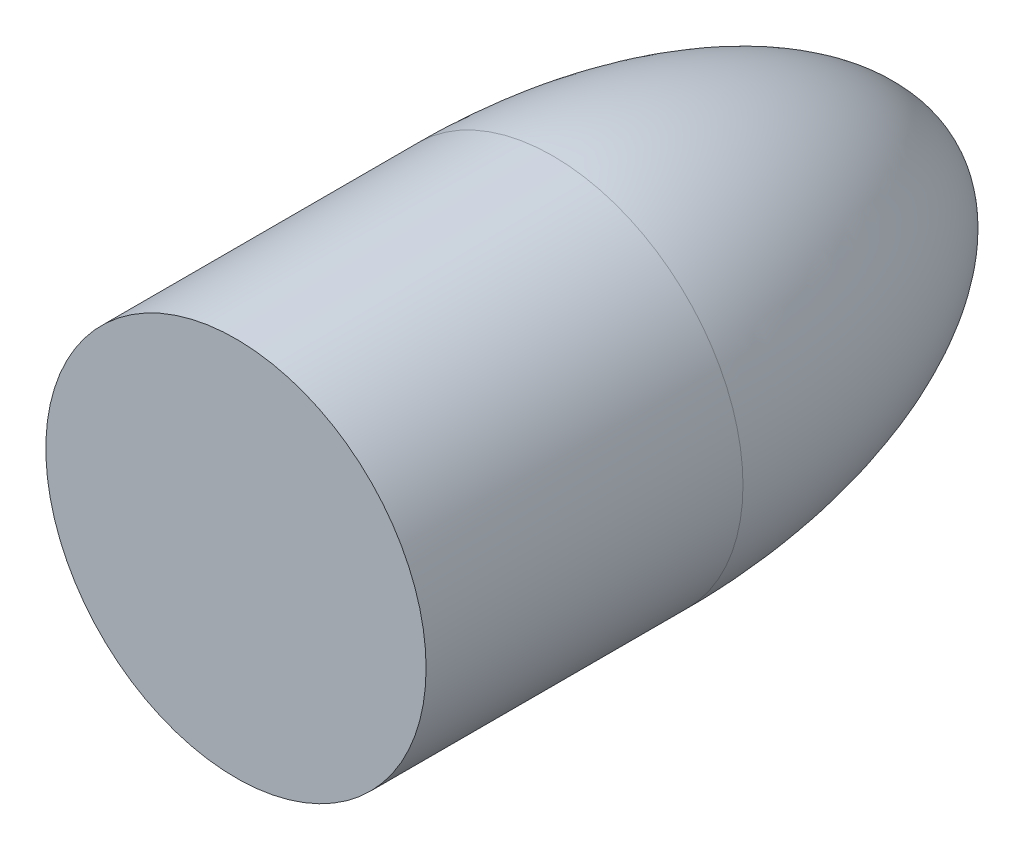
from build123d import *

# Parameters (mm, degrees)
SKETCH2_R           = 76.2
BOSS_EXTRUDE1_DEPTH = 127


with BuildPart() as part:
    # Sketch1 → Revolve1 (revolve)
    with BuildSketch(Plane(origin=(0, 0, 0), x_dir=(0, 0, -1), z_dir=(1, 0, 0))):
        with BuildLine():
            Line((0, 76.2), (0, 0))
            Line((0, 0), (152.4, 0))
            add(Edge.make_bspline(
                [(0, 76.2), (0.668289372, 76.2), (1.658377172, 76.196565322), (3.3475509, 76.185116398), (5.389853733, 76.15419687), (7.614877607, 76.109523753), (10.11699106, 76.037326106), (13.024492925, 75.927217822), (15.907103003, 75.789433001), (18.800559435, 75.623871169), (22.407781556, 75.382046396), (26.736601143, 75.035775637), (31.056706665, 74.618789713), (35.370872642, 74.130044616), (38.959265844, 73.674277381), (41.826515288, 73.280292829), (45.404997538, 72.750716915), (49.690121518, 72.055197513), (56.098298794, 70.897335382), (63.17836502, 69.40144931), (70.208811144, 67.686418914), (78.57143632, 65.349923384), (86.848909349, 62.723053301), (96.353872922, 59.205377282), (106.424617467, 54.721838361), (114.878251498, 50.221725855), (121.774263974, 45.922163688), (127.212316476, 42.047451876), (131.728642674, 38.421956079), (136.00130823, 34.510730011), (139.702159514, 30.582581399), (142.786533548, 26.756971466), (145.295615962, 23.10575563), (147.289840932, 19.698731723), (148.978819683, 16.224644789), (150.335170018, 12.715052828), (151.350644993, 9.207585726), (152.061016263, 5.5827392), (152.334424833, 2.8676648), (152.399993954, 1.007275164), (152.4, 0)],
                knots=[0.076303916, 0.076303916, 0.076303916, 0.076303916, 0.076303916, 0.090787477, 0.098029258, 0.105271039, 0.1197546, 0.134238162, 0.148721723, 0.163205284, 0.177688846, 0.192172407, 0.221139528, 0.250106649, 0.264590211, 0.279073773, 0.293557335, 0.308040897, 0.337008017, 0.365975138, 0.423909383, 0.452876511, 0.481843638, 0.539777878, 0.597712087, 0.655646309, 0.702351241, 0.73131838, 0.760285411, 0.789252503, 0.818219412, 0.847186307, 0.868213707, 0.887525224, 0.906834297, 0.926144791, 0.945460912, 0.962753387, 0.979837386, 1, 1, 1, 1, 1], degree=4))
        make_face()
    revolve(axis=Axis((0, 0, -480.06), (0, 0, 1)))

    # Sketch2 → Boss-Extrude1 (add)
    with BuildSketch(Plane.XY):
        Circle(SKETCH2_R)
    extrude(amount=BOSS_EXTRUDE1_DEPTH)


solid = part.part
